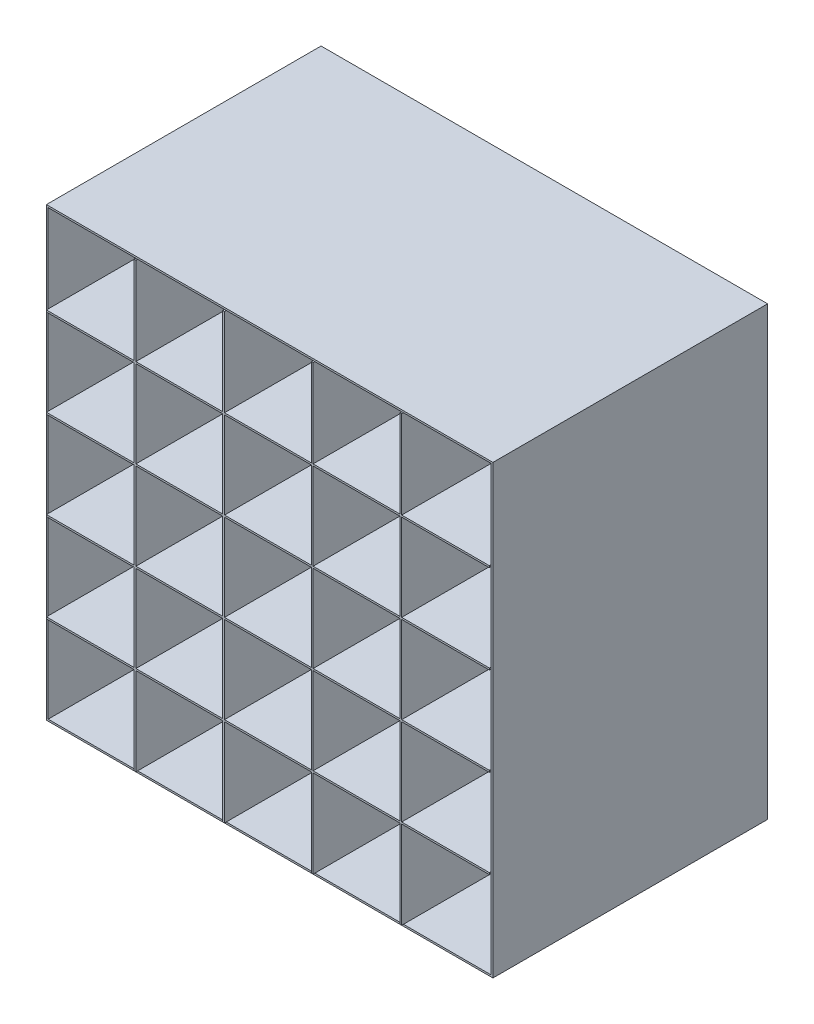
from build123d import *

# Parameters (mm, degrees)
SKETCH1_W                = 252
SKETCH1_H                = 252
SKETCH1_W_2              = 250
SKETCH1_H_2              = 250
BOSS_EXTRUDE1_DEPTH      = 50
BOSS_EXTRUDE2_DEPTH      = 5
BOSS_EXTRUDE2_DEPTH_BACK = 1
SKETCH2_W                = 252
SKETCH2_H                = 252
SKETCH3_W                = 250
SKETCH3_H                = 0.992840874
SKETCH3_H_2              = 1
SKETCH3_W_2              = 1
SKETCH3_H_3              = 250
BOSS_EXTRUDE3_DEPTH      = 50
SKETCH4_R                = 2.5
CUT_EXTRUDE1_DEPTH       = 186.072958587
BOSS_EXTRUDE4_DEPTH      = 50
SKETCH6_W                = 252
SKETCH6_H                = 252
SKETCH6_W_2              = 250
SKETCH6_H_2              = 250
BOSS_EXTRUDE6_DEPTH      = 100
SKETCH7_W                = 250
SKETCH7_H                = 2.5
BOSS_EXTRUDE7_DEPTH      = 50
CUT_EXTRUDE2_DEPTH       = 50


with BuildPart() as part:
    # Sketch1 → Boss-Extrude1 (new body)
    with BuildSketch(Plane.XY):
        Rectangle(SKETCH1_W, SKETCH1_H)
        Rectangle(SKETCH1_W_2, SKETCH1_H_2, mode=Mode.SUBTRACT)
    extrude(amount=BOSS_EXTRUDE1_DEPTH)

    # Sketch2 → Boss-Extrude2 (add, two sides: drawn at the far end of the back side and taken through both)
    with BuildSketch(Plane(origin=(0, 0, 0), x_dir=(-1, 0, 0), z_dir=(0, 0, -1)).offset(-BOSS_EXTRUDE2_DEPTH_BACK)):
        Rectangle(SKETCH2_W, SKETCH2_H)
    extrude(amount=BOSS_EXTRUDE2_DEPTH + BOSS_EXTRUDE2_DEPTH_BACK)

    # Sketch3 → Boss-Extrude3 (add)
    with BuildSketch(Plane.XY.offset(1)):
        with Locations((0, 75.003579563)):
            Rectangle(SKETCH3_W, SKETCH3_H)
        with Locations((0, 25)):
            Rectangle(SKETCH3_W, SKETCH3_H_2)
        with Locations((0, -25)):
            Rectangle(SKETCH3_W, SKETCH3_H_2)
        with Locations((0, -75)):
            Rectangle(SKETCH3_W, SKETCH3_H_2)
        with Locations((-75, 0)):
            Rectangle(SKETCH3_W_2, SKETCH3_H_3)
        with Locations((-25, 0)):
            Rectangle(SKETCH3_W_2, SKETCH3_H_3)
        with Locations((25, 0)):
            Rectangle(SKETCH3_W_2, SKETCH3_H_3)
        with Locations((75, 0)):
            Rectangle(SKETCH3_W_2, SKETCH3_H_3)
    extrude(amount=BOSS_EXTRUDE3_DEPTH)

    # Sketch4 → Cut-Extrude1 (cut, through all)
    with BuildSketch(Plane.XY.offset(1)):
        with Locations((-100, 98.688621777)):
            Circle(SKETCH4_R)
        with Locations((-50, 98.688621777)):
            Circle(SKETCH4_R)
        with Locations((0, 98.688621777)):
            Circle(SKETCH4_R)
        with Locations((50, 98.688621777)):
            Circle(SKETCH4_R)
        with Locations((100, 98.688621777)):
            Circle(SKETCH4_R)
        with Locations((-50, 48.688621777)):
            Circle(SKETCH4_R)
        with Locations((0, 48.688621777)):
            Circle(SKETCH4_R)
        with Locations((50, 48.688621777)):
            Circle(SKETCH4_R)
        with Locations((100, 48.688621777)):
            Circle(SKETCH4_R)
        with Locations((-50, -1.311378223)):
            Circle(SKETCH4_R)
        with Locations((0, -1.311378223)):
            Circle(SKETCH4_R)
        with Locations((50, -1.311378223)):
            Circle(SKETCH4_R)
        with Locations((100, -1.311378223)):
            Circle(SKETCH4_R)
        with Locations((-50, -51.311378223)):
            Circle(SKETCH4_R)
        with Locations((0, -51.311378223)):
            Circle(SKETCH4_R)
        with Locations((50, -51.311378223)):
            Circle(SKETCH4_R)
        with Locations((100, -51.311378223)):
            Circle(SKETCH4_R)
        with Locations((-50, -101.311378223)):
            Circle(SKETCH4_R)
        with Locations((0, -101.311378223)):
            Circle(SKETCH4_R)
        with Locations((50, -101.311378223)):
            Circle(SKETCH4_R)
        with Locations((100, -101.311378223)):
            Circle(SKETCH4_R)
        with Locations((-100, 48.688621777)):
            Circle(SKETCH4_R)
        with Locations((-100, -1.311378223)):
            Circle(SKETCH4_R)
        with Locations((-100, -51.311378223)):
            Circle(SKETCH4_R)
        with Locations((-100, -101.311378223)):
            Circle(SKETCH4_R)
    extrude(amount=-CUT_EXTRUDE1_DEPTH, mode=Mode.SUBTRACT)

    # Sketch5 → Boss-Extrude4 (add)
    with BuildSketch(Plane(origin=(0, 0, -5), x_dir=(-1, 0, 0), z_dir=(0, 0, -1))):
        Polygon((-100, 96.188621777), (126, 96.188621777), (126, 93.688621777), (-126, 93.688621777), (-126, 96.188621777), align=None)
        Polygon((-100, 46.188621777), (126, 46.188621777), (126, 43.688621777), (-126, 43.688621777), (-126, 46.188621777), align=None)
        Polygon((-100, -3.811378223), (126, -3.811378223), (126, -6.311378223), (-126, -6.311378223), (-126, -3.811378223), align=None)
        Polygon((-100, -53.811378223), (126, -53.811378223), (126, -56.311378223), (-126, -56.311378223), (-126, -53.811378223), align=None)
        Polygon((-100, -103.811378223), (126, -103.811378223), (126, -106.311378223), (-126, -106.311378223), (-126, -103.811378223), align=None)
    extrude(amount=BOSS_EXTRUDE4_DEPTH)

    # Sketch6 → Boss-Extrude6 (add)
    with BuildSketch(Plane(origin=(0, 0, -5), x_dir=(-1, 0, 0), z_dir=(0, 0, -1))):
        Rectangle(SKETCH6_W, SKETCH6_H)
        Rectangle(SKETCH6_W_2, SKETCH6_H_2, mode=Mode.SUBTRACT)
    extrude(amount=BOSS_EXTRUDE6_DEPTH)

    # Sketch7 → Boss-Extrude7 (add)
    with BuildSketch(Plane(origin=(0, 0, -55), x_dir=(-1, 0, 0), z_dir=(0, 0, -1))):
        with Locations((0, -5.061378223)):
            Rectangle(SKETCH7_W, SKETCH7_H)
    extrude(amount=BOSS_EXTRUDE7_DEPTH)

    # Sketch8 → Cut-Extrude2 (cut)
    with BuildSketch(Plane(origin=(0, -3.811378223, 0), x_dir=(1, 0, 0), z_dir=(0, 1, 0))):
        with BuildLine():
            Line((-100, 85), (-50, 85))
            ThreePointArc((-50, 85), (-45, 80), (-50, 75))
            Line((-50, 75), (-100, 75))
            ThreePointArc((-100, 75), (-105, 80), (-100, 85))
        make_face()
        with BuildLine():
            Line((50, 85), (100, 85))
            ThreePointArc((100, 85), (105, 80), (100, 75))
            Line((100, 75), (50, 75))
            ThreePointArc((50, 75), (45, 80), (50, 85))
        make_face()
    extrude(amount=-CUT_EXTRUDE2_DEPTH, mode=Mode.SUBTRACT)


solid = part.part
